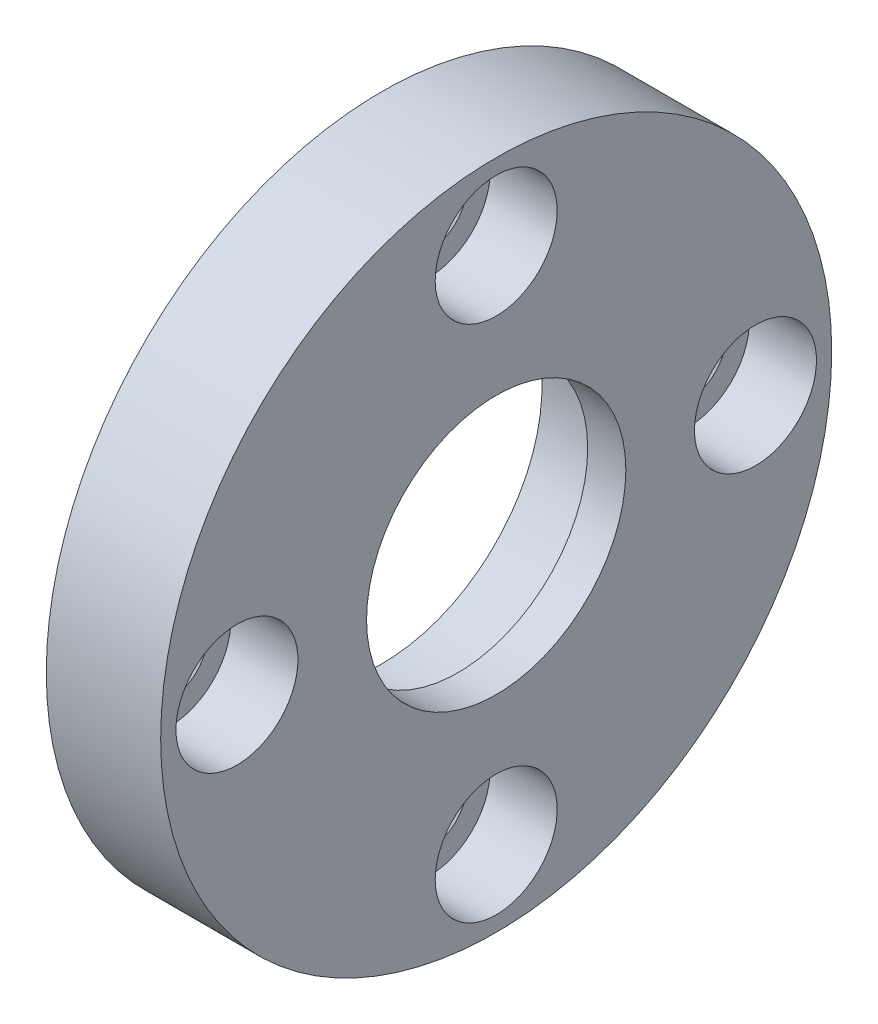
from build123d import *

# Parameters (mm, degrees)
SKETCH_1_W = 7.5
SKETCH_1_H = 22


with BuildPart() as part:
    # ｽｹｯﾁ1 → 回転1 (revolve)
    with BuildSketch(Plane.XY, mode=Mode.PRIVATE) as revolve_1_sk:
        with Locations((0, 11)):
            Rectangle(SKETCH_1_W, SKETCH_1_H)
    revolve(revolve_1_sk.sketch.rotate(Axis((3.75, 0, 0), (-1, 0, 0)), 270), axis=Axis((3.75, 0, 0), (-1, 0, 0)))

    # ｽｹｯﾁ2 → ｶｯﾄ - 回転1 (revolve, cut)
    with BuildSketch(Plane.XY, mode=Mode.PRIVATE) as cut_revolve_1_sk:
        Polygon((-3.75, 0), (-3.75, 10.5), (1.25, 10.5), (1.25, 8.5), (3.75, 8.5), (3.75, 0), align=None)
    revolve(cut_revolve_1_sk.sketch.rotate(Axis((3.75, 0, 0), (-1, 0, 0)), 270), axis=Axis((3.75, 0, 0), (-1, 0, 0)), mode=Mode.SUBTRACT)

    # ｽｹｯﾁ3 → ｶｯﾄ - 回転2 (revolve, cut)
    with BuildSketch(Plane.XY, mode=Mode.PRIVATE) as cut_revolve_2_sk:
        Polygon((-3.75, 17), (-3.75, 19.5), (-3.317, 19.067), (-1.083, 19.067), (-0.65, 19.5), (-0.65, 21), (3.75, 21), (3.75, 17), align=None)
    revolve(cut_revolve_2_sk.sketch.rotate(Axis((3.75, 17, 0), (-1, 0, 0)), 270), axis=Axis((3.75, 17, 0), (-1, 0, 0)), mode=Mode.SUBTRACT)

    # ｽｹｯﾁ4 → ｶｯﾄ - 回転3 (revolve, cut)
    with BuildSketch(Plane.XY.offset(17), mode=Mode.PRIVATE) as cut_revolve_3_sk:
        Polygon((-3.75, 0), (-3.75, 2.5), (-3.317, 2.067), (-1.083, 2.067), (-0.65, 2.5), (-0.65, 4), (3.75, 4), (3.75, 0), align=None)
    revolve(cut_revolve_3_sk.sketch.rotate(Axis((3.75, 0, 17), (-1, 0, 0)), 270), axis=Axis((3.75, 0, 17), (-1, 0, 0)), mode=Mode.SUBTRACT)

    # ｽｹｯﾁ5 → ｶｯﾄ - 回転4 (revolve, cut)
    with BuildSketch(Plane.XY, mode=Mode.PRIVATE) as cut_revolve_4_sk:
        Polygon((-3.75, -17), (-3.75, -14.5), (-3.317, -14.933), (-1.083, -14.933), (-0.65, -14.5), (-0.65, -13), (3.75, -13), (3.75, -17), align=None)
    revolve(cut_revolve_4_sk.sketch.rotate(Axis((3.75, -17, 0), (-1, 0, 0)), 270), axis=Axis((3.75, -17, 0), (-1, 0, 0)), mode=Mode.SUBTRACT)

    # ｽｹｯﾁ6 → ｶｯﾄ - 回転5 (revolve, cut)
    with BuildSketch(Plane.XY.offset(-17), mode=Mode.PRIVATE) as cut_revolve_5_sk:
        Polygon((-3.75, 0), (-3.75, 2.5), (-3.317, 2.067), (-1.083, 2.067), (-0.65, 2.5), (-0.65, 4), (3.75, 4), (3.75, 0), align=None)
    revolve(cut_revolve_5_sk.sketch.rotate(Axis((3.75, 0, -17), (-1, 0, 0)), 270), axis=Axis((3.75, 0, -17), (-1, 0, 0)), mode=Mode.SUBTRACT)


solid = part.part
